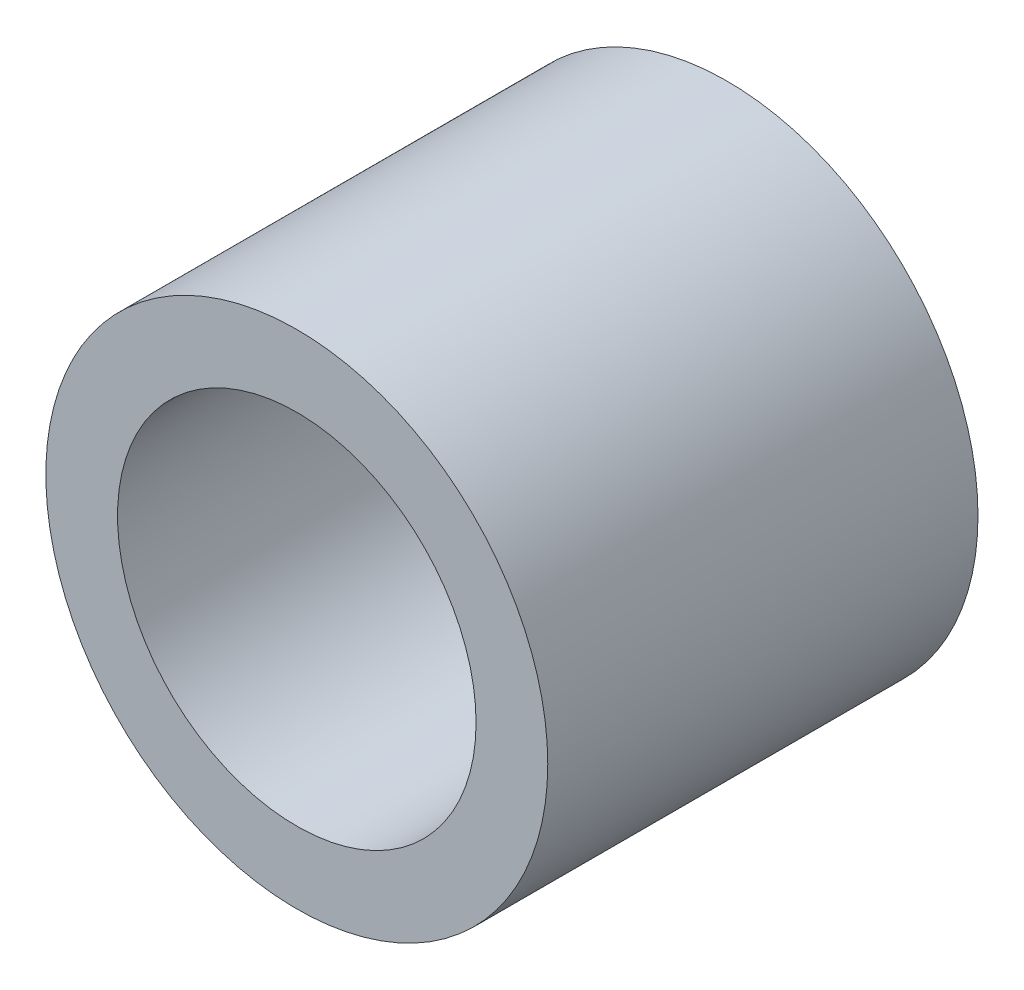
from build123d import *

# Parameters (mm, degrees)
SKETCH_1_R      = 7
SKETCH_1_R_2    = 5
EXTRUDE_1_DEPTH = 12


with BuildPart() as part:
    # 草图1 → 凸台-拉伸1 (new body)
    with BuildSketch(Plane.XY):
        Circle(SKETCH_1_R)
        Circle(SKETCH_1_R_2, mode=Mode.SUBTRACT)
    extrude(amount=EXTRUDE_1_DEPTH)


solid = part.part
